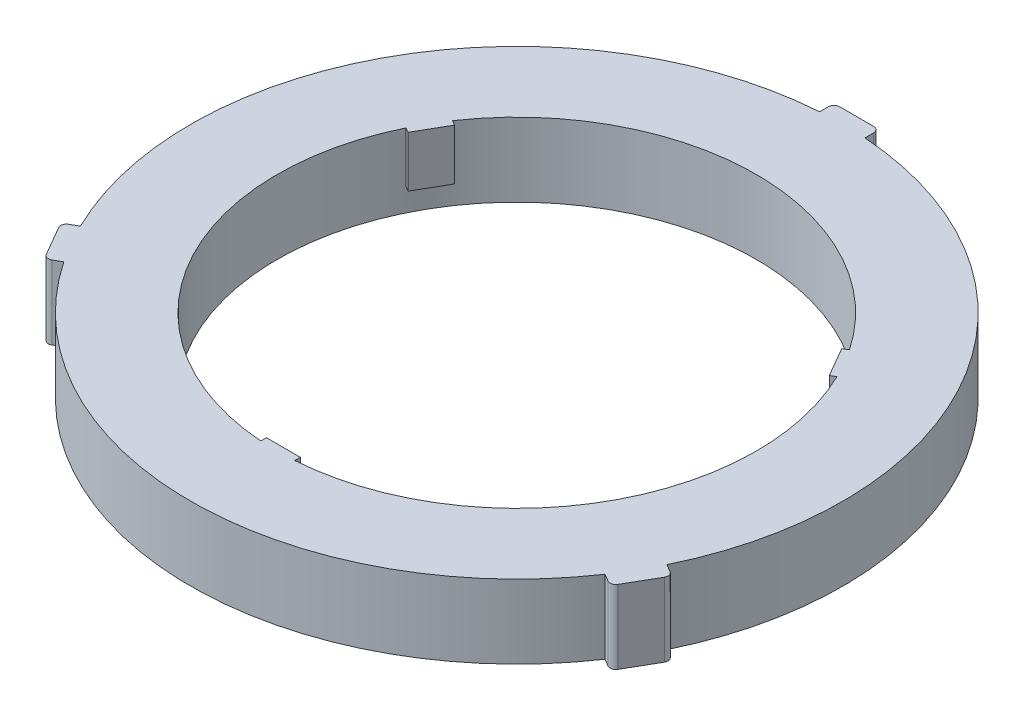
from build123d import *
from build123d.topology import SkipClean

# Parameters (mm, degrees)
BOSS_EXTRUDE1_DEPTH = 6.5
FILLET1_R           = 0.5
CUT_EXTRUDE1_DEPTH  = 2


with BuildPart() as part:
    # Sketch1 → Boss-Extrude1 (new body)
    with BuildSketch(Plane(origin=(0, 0, 0), x_dir=(1, 0, 0), z_dir=(0, 1, 0))):
        with BuildLine():
            ThreePointArc((25.881318293, -12.633185007), (24.941531629, 14.4), (2, 28.730471629))
            Line((2, 28.730471629), (2, 30))
            Line((2, 30), (-2, 30))
            Line((-2, 30), (-2, 28.730471629))
            ThreePointArc((-2, 28.730471629), (-24.941531629, 14.4), (-25.881318293, -12.633185007))
            Line((-25.881318293, -12.633185007), (-26.980762114, -13.267949192))
            Line((-26.980762114, -13.267949192), (-24.980762114, -16.732050808))
            Line((-24.980762114, -16.732050808), (-23.881318293, -16.097286622))
            ThreePointArc((-23.881318293, -16.097286622), (0, -28.8), (23.881318293, -16.097286622))
            Line((23.881318293, -16.097286622), (24.980762114, -16.732050808))
            Line((24.980762114, -16.732050808), (26.980762114, -13.267949192))
            Line((26.980762114, -13.267949192), (25.881318293, -12.633185007))
        make_face()
        with BuildLine():
            ThreePointArc((-1.5, -21.096741455), (-18.31643729, -10.575), (-19.020314037, 9.249332622))
            Line((-19.020314037, 9.249332622), (-18.590123318, 9.000961894))
            Line((-18.590123318, 9.000961894), (-17.090123318, 11.599038106))
            Line((-17.090123318, 11.599038106), (-17.520314037, 11.847408833))
            ThreePointArc((-17.520314037, 11.847408833), (0, 21.15), (17.520314037, 11.847408833))
            Line((17.520314037, 11.847408833), (17.090123318, 11.599038106))
            Line((17.090123318, 11.599038106), (18.590123318, 9.000961894))
            Line((18.590123318, 9.000961894), (19.020314037, 9.249332622))
            ThreePointArc((19.020314037, 9.249332622), (18.31643729, -10.575), (1.5, -21.096741455))
            Line((1.5, -21.096741455), (1.5, -20.6))
            Line((1.5, -20.6), (-1.5, -20.6))
            Line((-1.5, -20.6), (-1.5, -21.096741455))
        make_face(mode=Mode.SUBTRACT)
    extrude(amount=BOSS_EXTRUDE1_DEPTH)

    # Fillet1
    fillet1_edges = [part.edges().sort_by_distance(p)[0] for p in [
        (-24.980762114, 3.25, 16.732050808),
        (-26.980762114, 3.25, 13.267949192),
        (-2, 3.25, -30),
        (2, 3.25, -30),
        (26.980762114, 3.25, 13.267949192),
        (24.980762114, 3.25, 16.732050808),
    ]]
    fillet(fillet1_edges, radius=FILLET1_R)

    # Sketch1<5> → Cut-Extrude1 (cut)
    with SkipClean():  # the faces are left unmerged after this step: merging them gives an invalid solid
        with BuildSketch(Plane(origin=(0, 0, 0), x_dir=(1, 0, 0), z_dir=(0, 1, 0))):
            with BuildLine():
                Line((-1.5, -20.6), (-1.5, -21.096741455))
                ThreePointArc((-1.5, -21.096741455), (0, -21.15), (1.5, -21.096741455))
                Line((1.5, -21.096741455), (1.5, -20.6))
                Line((1.5, -20.6), (-1.5, -20.6))
            make_face()
            with BuildLine():
                ThreePointArc((-17.520314037, 11.847408833), (-18.31643729, 10.575), (-19.020314037, 9.249332622))
                Line((-19.020314037, 9.249332622), (-18.590123318, 9.000961894))
                Line((-18.590123318, 9.000961894), (-17.090123318, 11.599038106))
                Line((-17.090123318, 11.599038106), (-17.520314037, 11.847408833))
            make_face()
            with BuildLine():
                Line((18.590123318, 9.000961894), (19.020314037, 9.249332622))
                ThreePointArc((19.020314037, 9.249332622), (18.31643729, 10.575), (17.520314037, 11.847408833))
                Line((17.520314037, 11.847408833), (17.090123318, 11.599038106))
                Line((17.090123318, 11.599038106), (18.590123318, 9.000961894))
            make_face()
        extrude(amount=CUT_EXTRUDE1_DEPTH, mode=Mode.SUBTRACT)


solid = part.part
